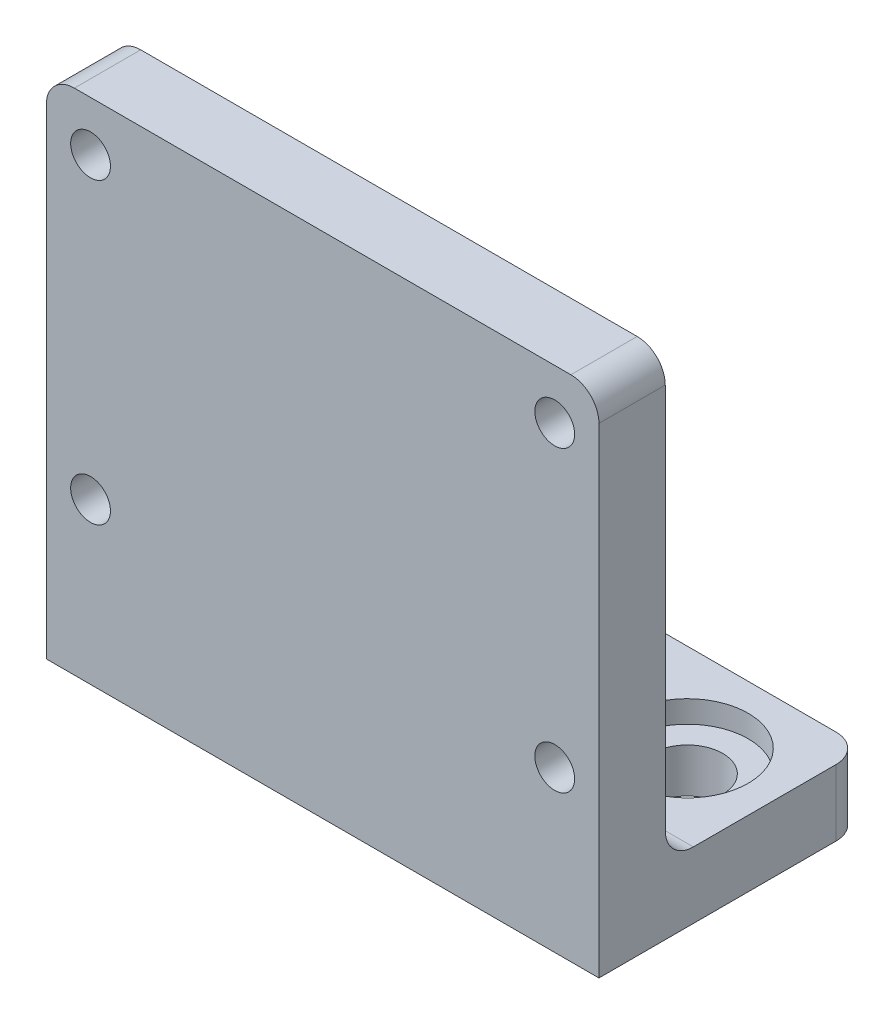
from build123d import *

# Parameters (mm, degrees)
SKETCH1_W                       = 25
SKETCH1_H                       = 23
SKETCH1_R                       = 0.9
BOSS_EXTRUDE1_DEPTH             = 3
BOSS_EXTRUDE2_REACH             = 21.007
BOSS_EXTRUDE2_DIRECTION_2_REACH = 21.007
SKETCH3_W                       = 11.5
SKETCH3_H                       = 9
CUT_EXTRUDE1_DEPTH              = 20
SKETCH4_R                       = 1.6
CUT_EXTRUDE2_DEPTH              = 27.462237245
SKETCH5_R                       = 2.75
CUT_EXTRUDE3_DEPTH              = 1
FILLET2_R                       = 1.27


with BuildPart() as part:
    # Sketch1 → Boss-Extrude1 (new body)
    with BuildSketch(Plane.XY):
        with Locations((0, -2.5)):
            Rectangle(SKETCH1_W, SKETCH1_H)
        with Locations((-10.5, 6.75)):
            Circle(SKETCH1_R, mode=Mode.SUBTRACT)
        with Locations((10.5, 6.75)):
            Circle(SKETCH1_R, mode=Mode.SUBTRACT)
        with Locations((10.5, -6.75)):
            Circle(SKETCH1_R, mode=Mode.SUBTRACT)
        with Locations((-10.5, -6.75)):
            Circle(SKETCH1_R, mode=Mode.SUBTRACT)
    extrude(amount=-BOSS_EXTRUDE1_DEPTH)

    # Boss-Extrude2: up to this face of the body (flat: up to its plane)
    boss_extrude2_end = Plane(part.part.faces().sort_by_distance((12.5, -2.5, -1.5))[0])
    # Sketch2 → Boss-Extrude2 (add, up to the picked face)
    with BuildSketch(Plane(origin=(0, 0, 0), x_dir=(0, 0, -1), z_dir=(1, 0, 0)), mode=Mode.PRIVATE) as boss_extrude2_sk1:
        Polygon((3, 9), (12, -11), (12, -14), (3, -14), align=None)
    boss_extrude2_tool1 = split(extrude(boss_extrude2_sk1.sketch, amount=BOSS_EXTRUDE2_REACH, mode=Mode.PRIVATE), bisect_by=boss_extrude2_end, keep=Keep.BOTH, mode=Mode.PRIVATE)
    add(boss_extrude2_tool1.solids().sort_by(Axis((0, -6.217949, -6.346154), (1, 0, 0)))[0])

    # Boss-Extrude2 direction 2: up to this face of the body (flat: up to its plane)
    boss_extrude2_direction_2_end = Plane(part.part.faces().sort_by_distance((-12.5, -2.5, -1.5))[0])
    # Sketch2 → Boss-Extrude2 direction 2 (add, up to the picked face)
    with BuildSketch(Plane(origin=(0, 0, 0), x_dir=(0, 0, -1), z_dir=(1, 0, 0)), mode=Mode.PRIVATE) as boss_extrude2_direction_2_sk1:
        Polygon((3, 9), (12, -11), (12, -14), (3, -14), align=None)
    boss_extrude2_direction_2_tool1 = split(extrude(boss_extrude2_direction_2_sk1.sketch, amount=-BOSS_EXTRUDE2_DIRECTION_2_REACH, mode=Mode.PRIVATE), bisect_by=boss_extrude2_direction_2_end, keep=Keep.BOTH, mode=Mode.PRIVATE)
    add(boss_extrude2_direction_2_tool1.solids().sort_by(Axis((0, -6.217949, -6.346154), (-1, 0, 0)))[0])

    # Sketch3 → Cut-Extrude1 (cut)
    with BuildSketch(Plane(origin=(0, 9, 0), x_dir=(1, 0, 0), z_dir=(0, 1, 0))):
        with Locations((-6.75, 7.5)):
            Rectangle(SKETCH3_W, SKETCH3_H)
        with Locations((6.75, 7.5)):
            Rectangle(SKETCH3_W, SKETCH3_H)
    extrude(amount=-CUT_EXTRUDE1_DEPTH, mode=Mode.SUBTRACT)

    # Sketch4 → Cut-Extrude2 (cut, through all)
    with BuildSketch(Plane(origin=(0, -11, 0), x_dir=(1, 0, 0), z_dir=(0, 1, 0))):
        with Locations(Location((-8.5, 8, 0), (0, 0, 270))):
            Circle(SKETCH4_R)
        with Locations(Location((8.5, 8, 0), (0, 0, 90))):
            Circle(SKETCH4_R)
    extrude(amount=-CUT_EXTRUDE2_DEPTH, mode=Mode.SUBTRACT)

    # Sketch5 → Cut-Extrude3 (cut)
    with BuildSketch(Plane(origin=(0, -11, 0), x_dir=(1, 0, 0), z_dir=(0, 1, 0))):
        with Locations(Location((-8.5, 8, 0), (0, 0, 270))):
            Circle(SKETCH5_R)
        with Locations(Location((8.5, 8, 0), (0, 0, 270))):
            Circle(SKETCH5_R)
    extrude(amount=-CUT_EXTRUDE3_DEPTH, mode=Mode.SUBTRACT)

    # Fillet2
    fillet2_edges = [part.edges().sort_by_distance(p)[0] for p in [
        (-12.5, -12.5, -12),
        (12.5, -12.5, -12),
        (-1, -11, -7.5),
        (-6.75, -11, -3),
        (-1, -1, -3),
        (1, -1, -3),
        (1, -11, -7.5),
        (6.75, -11, -3),
        (-12.5, 9, -1.5),
        (12.5, 9, -1.5),
    ]]
    fillet(fillet2_edges, radius=FILLET2_R)


solid = part.part
